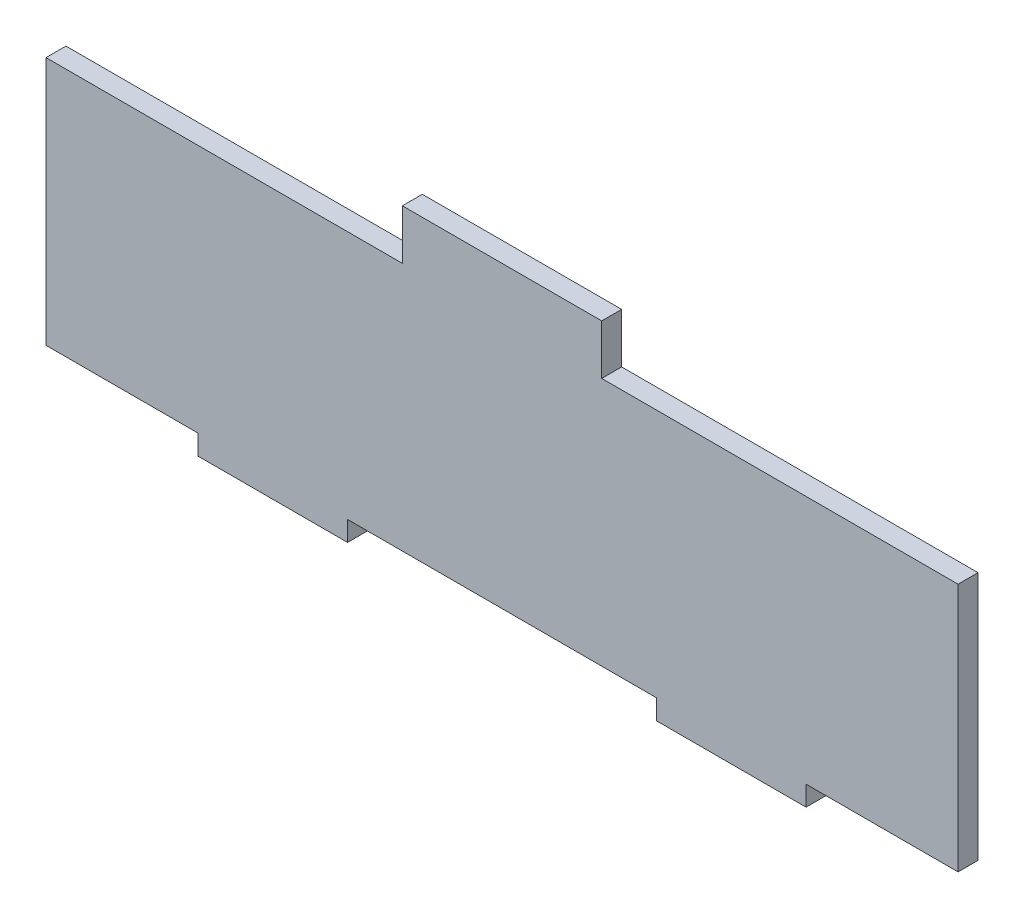
from build123d import *

# Parameters (mm, degrees)
SALIENTE_EXTRUIR1_DEPTH = 4


with BuildPart() as part:
    # Croquis1 → Saliente-Extruir1 (new body)
    with BuildSketch(Plane.XY):
        Polygon((-61, -25), (-61, -29), (-31, -29), (-31, -25), (31, -25), (31, -29), (61, -29), (61, -25), (91.5, -25), (91.5, 25), (20, 25), (20, 35), (-20, 35), (-20, 25), (-91.5, 25), (-91.5, -25), align=None)
    extrude(amount=SALIENTE_EXTRUIR1_DEPTH)


solid = part.part
